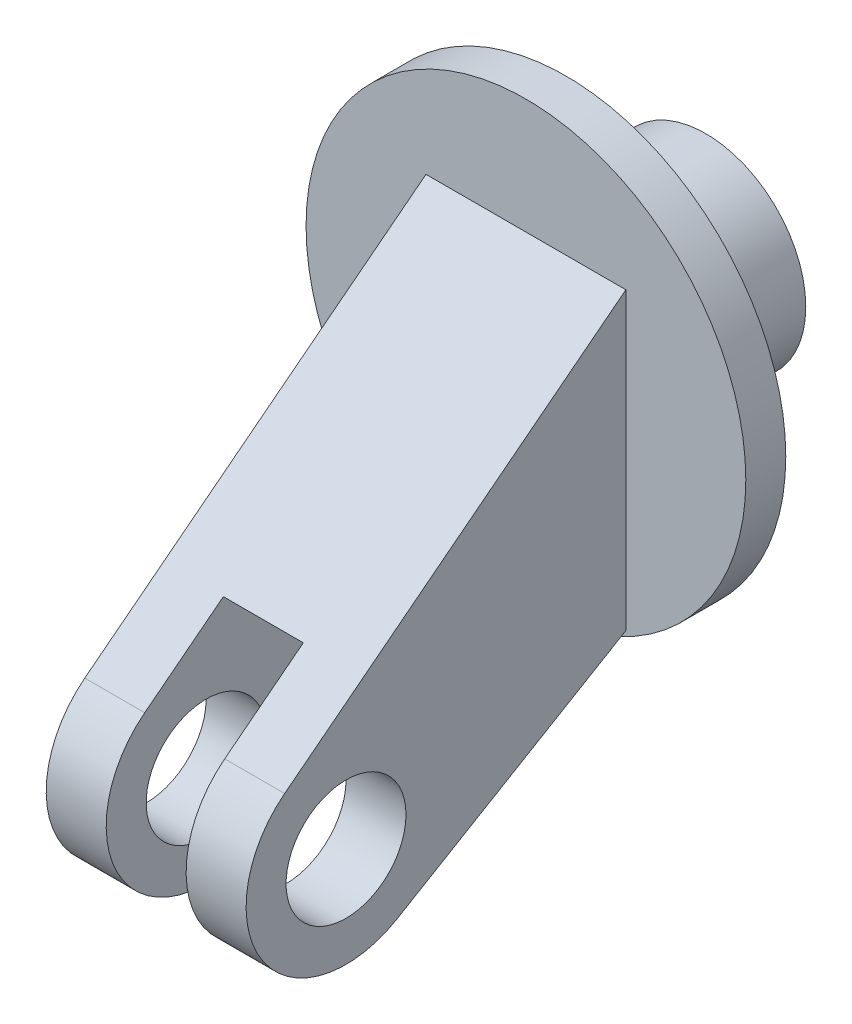
from build123d import *

# Parameters (mm, degrees)
SKETCH_1_R          = 55
EXTRUDE_1_DEPTH     = 10
SKETCH_2_R          = 25
EXTRUDE_2_DEPTH     = 35
SKETCH_3_R          = 25
SKETCH_3_R_2        = 15
EXTRUDE_3_DEPTH     = 25
SKETCH_6_R          = 35.302710026
CUT_EXTRUDE_2_DEPTH = 10


with BuildPart() as part:
    # 草图1 → 凸台-拉伸1 (new body)
    with BuildSketch(Plane.XY):
        Circle(SKETCH_1_R)
    extrude(amount=EXTRUDE_1_DEPTH)

    # 草图2 → 凸台-拉伸2 (add)
    with BuildSketch(Plane(origin=(0, 0, 0), x_dir=(-1, 0, 0), z_dir=(0, 0, -1))):
        with Locations(Location((0, 0, 0), (0, 0, 180))):
            Circle(SKETCH_2_R)
    extrude(amount=EXTRUDE_2_DEPTH)

    # 草图3 → 凸台-拉伸3 (add, symmetric)
    # profile 1 of 2: a face of its own
    with BuildSketch(Plane(origin=(0, 0, 0), x_dir=(0, 0, -1), z_dir=(1, 0, 0))):
        with BuildLine():
            Line((-67.276717973, -81.520178774), (-10, -47.656713047))
            Line((-10, -47.656713047), (-10, 26.1722221))
            Line((-10, 26.1722221), (-95.356612975, -40.272495395))
            ThreePointArc((-95.356612975, -40.272495395), (-69.020822535, -37.539865045), (-55, -60))
            ThreePointArc((-55, -60), (-58.285004597, -72.387855935), (-67.276717973, -81.520178774))
        make_face()
    # profile 2 of 2: a face of its own
    with BuildSketch(Plane(origin=(0, 0, 0), x_dir=(0, 0, -1), z_dir=(1, 0, 0))):
        with Locations((-80, -60)):
            Circle(SKETCH_3_R)
        with Locations((-80, -60)):
            Circle(SKETCH_3_R_2, mode=Mode.SUBTRACT)
    extrude(amount=EXTRUDE_3_DEPTH, both=True)

    # 草图6 → 切除-拉伸2 (cut, symmetric)
    with BuildSketch(Plane(origin=(0, 0, 0), x_dir=(0, 0, -1), z_dir=(1, 0, 0))):
        with Locations((-80, -60)):
            Circle(SKETCH_6_R)
    extrude(amount=CUT_EXTRUDE_2_DEPTH, both=True, mode=Mode.SUBTRACT)


solid = part.part
